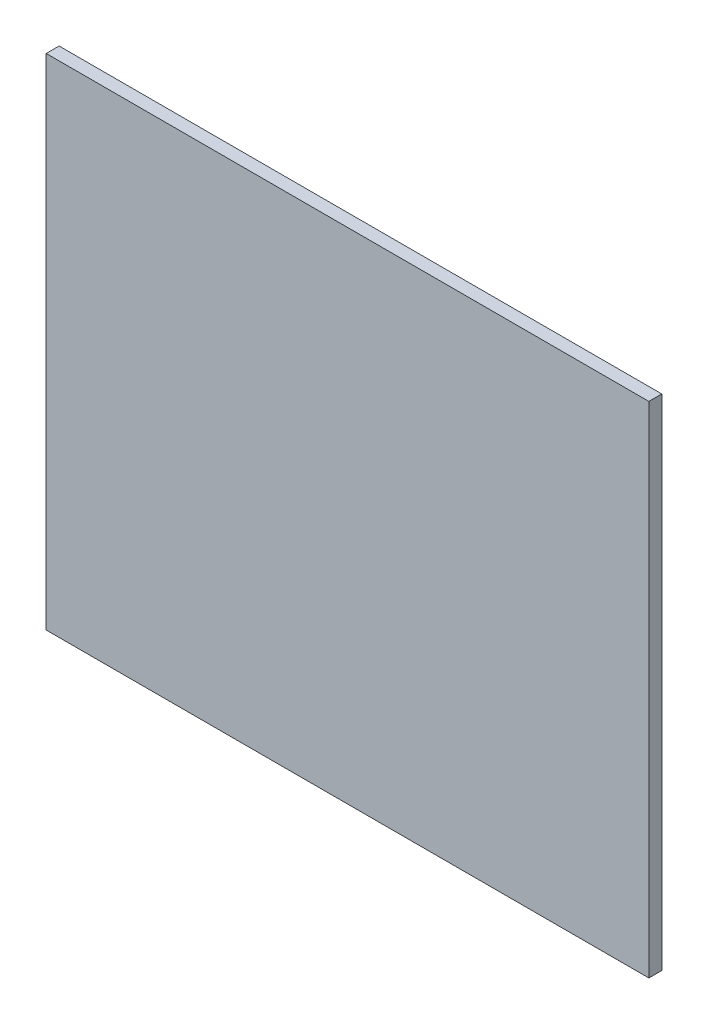
from build123d import *

# Parameters (mm, degrees)
IZIM1_W                     = 700
IZIM1_H                     = 580
Y_KSEKLIK_EKSTR_ZYON1_DEPTH = 15


with BuildPart() as part:
    # Çizim1 → Yükseklik-Ekstrüzyon1 (new body)
    with BuildSketch(Plane.XY):
        with Locations((350, 290)):
            Rectangle(IZIM1_W, IZIM1_H)
    extrude(amount=Y_KSEKLIK_EKSTR_ZYON1_DEPTH)


solid = part.part
